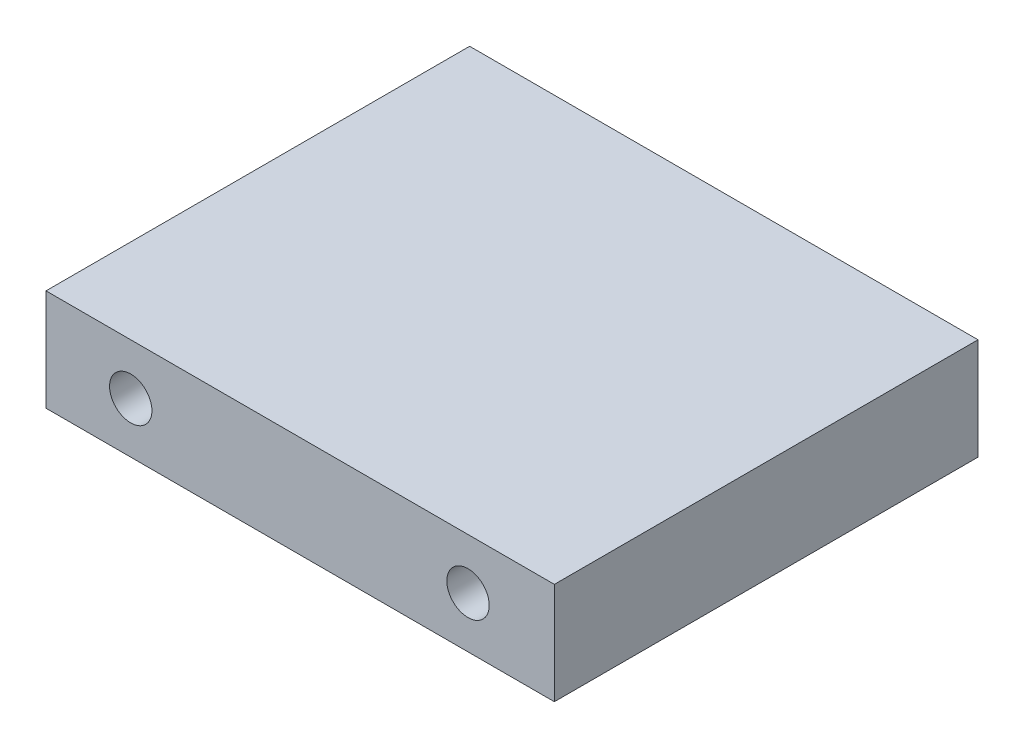
from build123d import *

# Parameters (mm, degrees)
ESQUISSE1_W                                   = 30
ESQUISSE1_H                                   = 25
BOSS_EXTRU_1_DEPTH                            = 6
TROU_POUR_TARAUDAGE_POUR_TROU_TARAUD_M3_D     = 2.5
TROU_POUR_TARAUDAGE_POUR_TROU_TARAUD_M3_DEPTH = 10
TROU_POUR_TARAUDAGE_POUR_TROU_TARAUD_M3_TIP   = 0.751075774
TROU_POUR_TARAUDAGE_POUR_TROU_TARAUD_2_D      = 2.5
TROU_POUR_TARAUDAGE_POUR_TROU_TARAUD_2_DEPTH  = 11
TROU_POUR_TARAUDAGE_POUR_TROU_TARAUD_2_TIP    = 0.751075774


with BuildPart() as part:
    # Esquisse1 → Boss.-Extru.1 (new body)
    with BuildSketch(Plane(origin=(0, 0, 0), x_dir=(1, 0, 0), z_dir=(0, 1, 0))):
        Rectangle(ESQUISSE1_W, ESQUISSE1_H)
    extrude(amount=BOSS_EXTRU_1_DEPTH)

    # Trou pour taraudage pour trou taraud_ M3
    with Locations(Plane.XY.offset(12.5)):
        with Locations((-10, 3), (9.903892631, 3.003728502)):
            Hole(TROU_POUR_TARAUDAGE_POUR_TROU_TARAUD_M3_D / 2, depth=TROU_POUR_TARAUDAGE_POUR_TROU_TARAUD_M3_DEPTH)
            with Locations((0, 0, -(TROU_POUR_TARAUDAGE_POUR_TROU_TARAUD_M3_DEPTH + TROU_POUR_TARAUDAGE_POUR_TROU_TARAUD_M3_TIP / 2))):  # 118° drill point
                Cone(0, TROU_POUR_TARAUDAGE_POUR_TROU_TARAUD_M3_D / 2, TROU_POUR_TARAUDAGE_POUR_TROU_TARAUD_M3_TIP, mode=Mode.SUBTRACT)

    # Trou pour taraudage pour trou taraud 2
    with Locations(Plane(origin=(0, 0, -12.5), x_dir=(-1, 0, 0), z_dir=(0, 0, -1))):
        with Locations((-7.5, 3), (7.5, 3)):
            Hole(TROU_POUR_TARAUDAGE_POUR_TROU_TARAUD_2_D / 2, depth=TROU_POUR_TARAUDAGE_POUR_TROU_TARAUD_2_DEPTH)
            with Locations((0, 0, -(TROU_POUR_TARAUDAGE_POUR_TROU_TARAUD_2_DEPTH + TROU_POUR_TARAUDAGE_POUR_TROU_TARAUD_2_TIP / 2))):  # 118° drill point
                Cone(0, TROU_POUR_TARAUDAGE_POUR_TROU_TARAUD_2_D / 2, TROU_POUR_TARAUDAGE_POUR_TROU_TARAUD_2_TIP, mode=Mode.SUBTRACT)


solid = part.part
